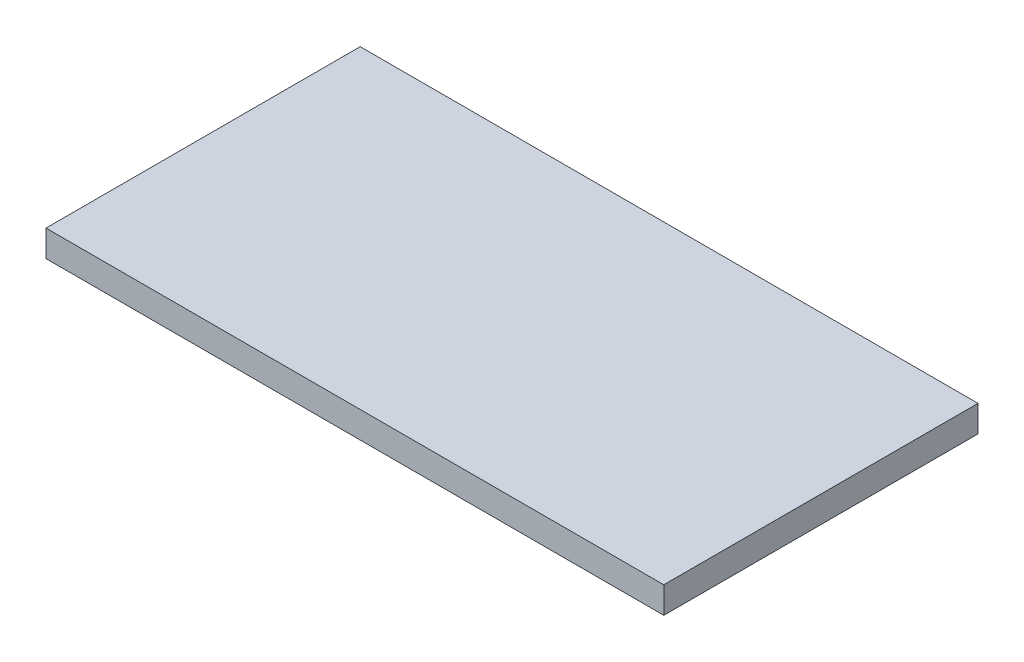
from build123d import *

# Parameters (mm, degrees)
SKETCH_1_W      = 70
SKETCH_1_H      = 35.6
EXTRUDE_1_DEPTH = 3


with BuildPart() as part:
    # 草图1 → 凸台-拉伸1 (new body)
    with BuildSketch(Plane(origin=(0, 0, 0), x_dir=(1, 0, 0), z_dir=(0, 1, 0))):
        with Locations((35, -17.8)):
            Rectangle(SKETCH_1_W, SKETCH_1_H)
    extrude(amount=EXTRUDE_1_DEPTH)


solid = part.part
